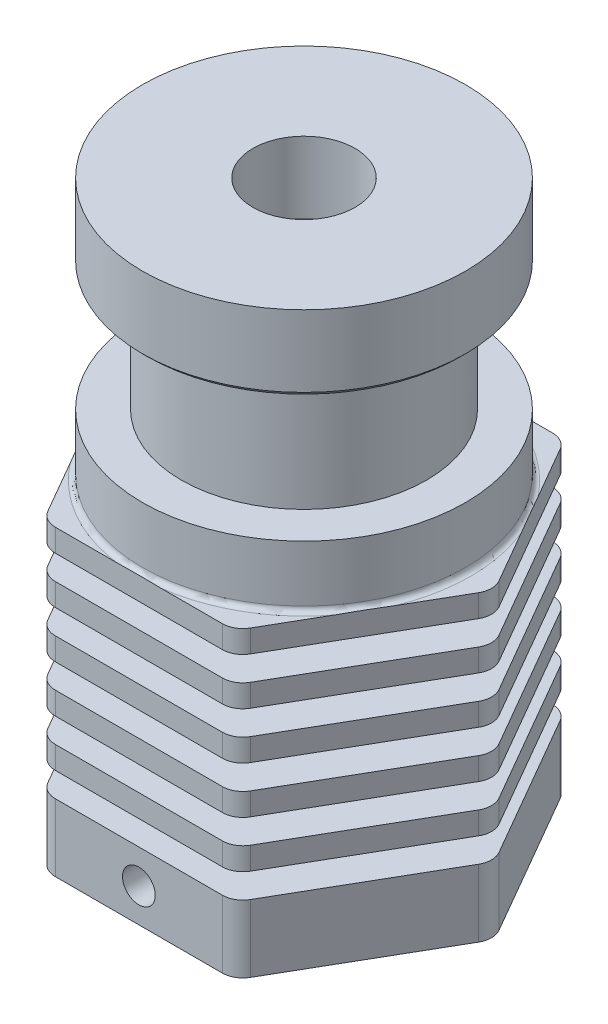
from build123d import *

# Parameters (mm, degrees)
FILLET1_R              = 0.25
SKETCH2_OUTSIDE_W      = 30.044
SKETCH2_OUTSIDE_H      = 30.044
CUT_EXTRUDE1_DEPTH     = 32.905485422
M2_TAPPED_HOLE1_REACH  = 36.101
M2_TAPPED_HOLE1_BORE_R = 0.8
CHAMFER1_SIZE          = 0.25
CHAMFER2_SIZE          = 0.5
CUT_EXTRUDE2_START     = -1
SKETCH6_R              = 7.9
CUT_EXTRUDE2_DEPTH     = 1
SKETCH7_W              = 4
SKETCH7_H              = 1.5


with BuildPart() as part:
    # Sketch1 → Revolve1 (revolve)
    with BuildSketch(Plane(origin=(0, 0, 0), x_dir=(0, 0, -1), z_dir=(1, 0, 0)), mode=Mode.PRIVATE) as revolve1_sk:
        Polygon((3, 0), (3, 3), (1.55, 3), (1.55, 24.1), (2.5, 24.1), (2.5, 28.6), (7.9, 28.6), (7.9, 23.85), (6, 23.85), (6, 19.3), (7.9, 19.3), (7.9, 14.8), (10, 14.8), (10, 13.7), (4.825, 13.7), (4.825, 12.5), (10, 12.5), (10, 11.4), (4.825, 11.4), (4.825, 10.2), (10, 10.2), (10, 9.1), (4.825, 9.1), (4.825, 7.9), (10, 7.9), (10, 6.8), (4.825, 6.8), (4.825, 5.6), (10, 5.6), (10, 4.5), (4.825, 4.5), (4.825, 3.3), (10, 3.3), (10, 0), align=None)
    revolve(revolve1_sk.sketch.rotate(Axis((0, 57.621425894, 0), (0, -1, 0)), 180), axis=Axis((0, 57.621425894, 0), (0, -1, 0)))

    # Fillet1
    fillet1_edges = [part.edges().sort_by_distance(p)[0] for p in [
        (0, 14.8, -7.9),
    ]]
    fillet(fillet1_edges, radius=FILLET1_R)

    # Sketch2 outside → Cut-Extrude1 (cut, through all)
    with BuildSketch(Plane(origin=(0, 28.6, 0), x_dir=(1, 0, 0), z_dir=(0, 1, 0))):
        Rectangle(SKETCH2_OUTSIDE_W, SKETCH2_OUTSIDE_H)
        with BuildLine():
            Line((-4.084753155, -8.075), (4.084753155, -8.075))
            ThreePointArc((4.084753155, -8.075), (4.584753155, -7.941025404), (4.950778558, -7.575))
            Line((4.950778558, -7.575), (9.035531713, -0.5))
            ThreePointArc((9.035531713, -0.5), (9.169506309, 0), (9.035531713, 0.5))
            Line((9.035531713, 0.5), (4.950778558, 7.575))
            ThreePointArc((4.950778558, 7.575), (4.584753155, 7.941025404), (4.084753155, 8.075))
            Line((4.084753155, 8.075), (-4.084753155, 8.075))
            ThreePointArc((-4.084753155, 8.075), (-4.584753155, 7.941025404), (-4.950778558, 7.575))
            Line((-4.950778558, 7.575), (-9.035531713, 0.5))
            ThreePointArc((-9.035531713, 0.5), (-9.169506309, 0), (-9.035531713, -0.5))
            Line((-9.035531713, -0.5), (-4.950778558, -7.575))
            ThreePointArc((-4.950778558, -7.575), (-4.584753155, -7.941025404), (-4.084753155, -8.075))
        make_face(mode=Mode.SUBTRACT)
    extrude(amount=-CUT_EXTRUDE1_DEPTH, mode=Mode.SUBTRACT)

    # M2 Tapped Hole1 bore → M2 Tapped Hole1 (cut, up to next)
    with BuildSketch(Plane.XY.offset(8.075), mode=Mode.PRIVATE) as m2_tapped_hole1_sk1:
        with Locations((0, 1.65)):
            Circle(M2_TAPPED_HOLE1_BORE_R)
    m2_tapped_hole1_tool1 = extrude(m2_tapped_hole1_sk1.sketch, amount=-M2_TAPPED_HOLE1_REACH, mode=Mode.PRIVATE) & part.part
    add(m2_tapped_hole1_tool1.solids().sort_by_distance((0, 1.65, 8.075))[0], mode=Mode.SUBTRACT)

    # Chamfer1
    chamfer1_edges = [part.edges().sort_by_distance(p)[0] for p in [
        (0, 19.3, -7.9),
        (0, 23.85, -7.9),
        (0, 28.6, -7.9),
    ]]
    chamfer(chamfer1_edges, length=CHAMFER1_SIZE)

    # Chamfer2
    chamfer2_edges = [part.edges().sort_by_distance(p)[0] for p in [
        (0, 28.6, -2.5),
    ]]
    chamfer(chamfer2_edges, length=CHAMFER2_SIZE)

    # Sketch6 → Cut-Extrude2 (cut)
    with BuildSketch(Plane(origin=(0, 28.6, 0), x_dir=(1, 0, 0), z_dir=(0, 1, 0)).offset(CUT_EXTRUDE2_START)):
        with Locations(Location((0, 0, 0), (0, 0, 270))):
            Circle(SKETCH6_R)
    extrude(amount=CUT_EXTRUDE2_DEPTH, mode=Mode.SUBTRACT)

    # Sketch7 → Cut-Revolve1 (revolve, cut)
    with BuildSketch(Plane(origin=(0, 0, 0), x_dir=(0, 0, -1), z_dir=(1, 0, 0))):
        with Locations((8, 18.55)):
            Rectangle(SKETCH7_W, SKETCH7_H)
    revolve(axis=Axis((0, 0, 0), (0, 1, 0)), mode=Mode.SUBTRACT)


solid = part.part
